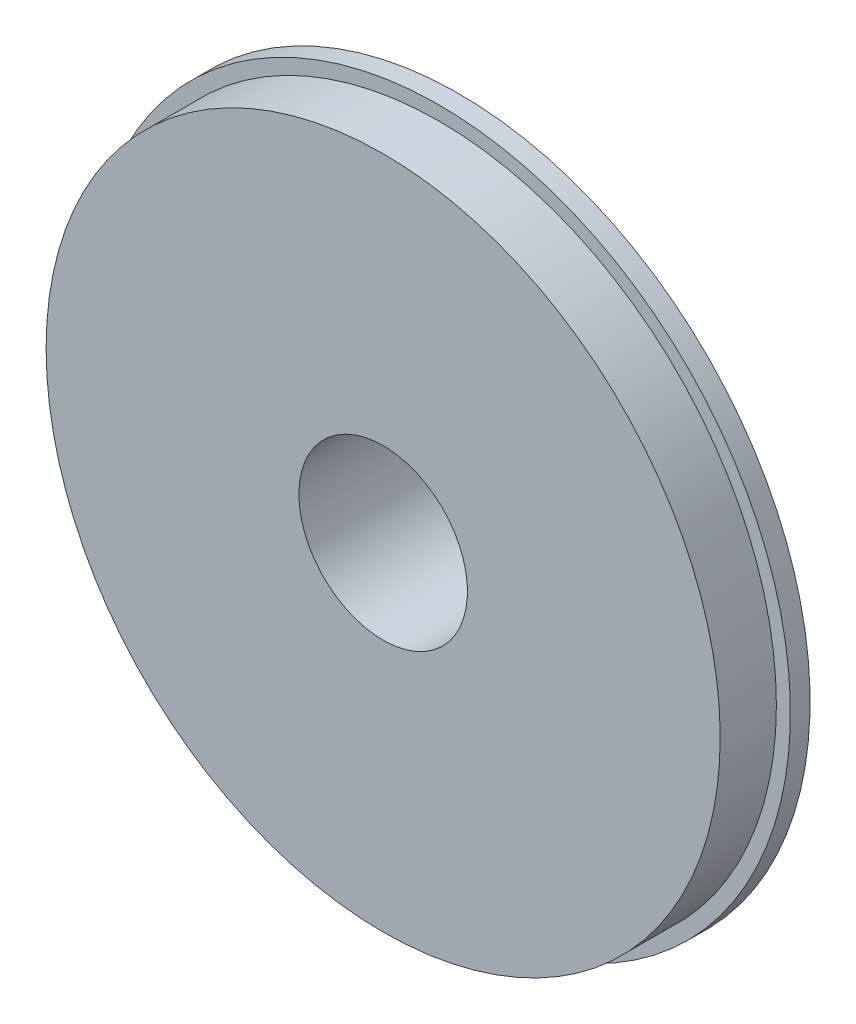
from build123d import *

# Parameters (mm, degrees)
SKETCH1_R           = 12
BOSS_EXTRUDE1_DEPTH = 2
SKETCH2_R           = 12.5
SKETCH2_R_2         = 11.5
BOSS_EXTRUDE2_DEPTH = 0.7
SKETCH3_R           = 3
CUT_EXTRUDE1_DEPTH  = 18.790446875
SKETCH4_R           = 7.5
BOSS_EXTRUDE4_DEPTH = 2.7
SKETCH5_R           = 3
CUT_EXTRUDE3_DEPTH  = 19.291801442


with BuildPart() as part:
    # Sketch1 → Boss-Extrude1 (new body)
    with BuildSketch(Plane.XY):
        Circle(SKETCH1_R)
    extrude(amount=BOSS_EXTRUDE1_DEPTH)

    # Sketch2 → Boss-Extrude2 (add)
    with BuildSketch(Plane(origin=(0, 0, 0), x_dir=(-1, 0, 0), z_dir=(0, 0, -1))):
        Circle(SKETCH2_R)
        Circle(SKETCH2_R_2, mode=Mode.SUBTRACT)
    extrude(amount=BOSS_EXTRUDE2_DEPTH)

    # Sketch3 → Cut-Extrude1 (cut, through all)
    with BuildSketch(Plane(origin=(0, 0, 0), x_dir=(-1, 0, 0), z_dir=(0, 0, -1))):
        Circle(SKETCH3_R)
    extrude(amount=-CUT_EXTRUDE1_DEPTH, mode=Mode.SUBTRACT)

    # Sketch4 → Boss-Extrude4 (add)
    with BuildSketch(Plane(origin=(0, 0, 0), x_dir=(-1, 0, 0), z_dir=(0, 0, -1))):
        with Locations(Location((0, 0, 0), (0, 0, 180))):
            Circle(SKETCH4_R)
    extrude(amount=BOSS_EXTRUDE4_DEPTH)

    # Sketch5 → Cut-Extrude3 (cut, through all)
    with BuildSketch(Plane(origin=(0, 0, -2.7), x_dir=(-1, 0, 0), z_dir=(0, 0, -1))):
        Circle(SKETCH5_R)
    extrude(amount=-CUT_EXTRUDE3_DEPTH, mode=Mode.SUBTRACT)


solid = part.part
